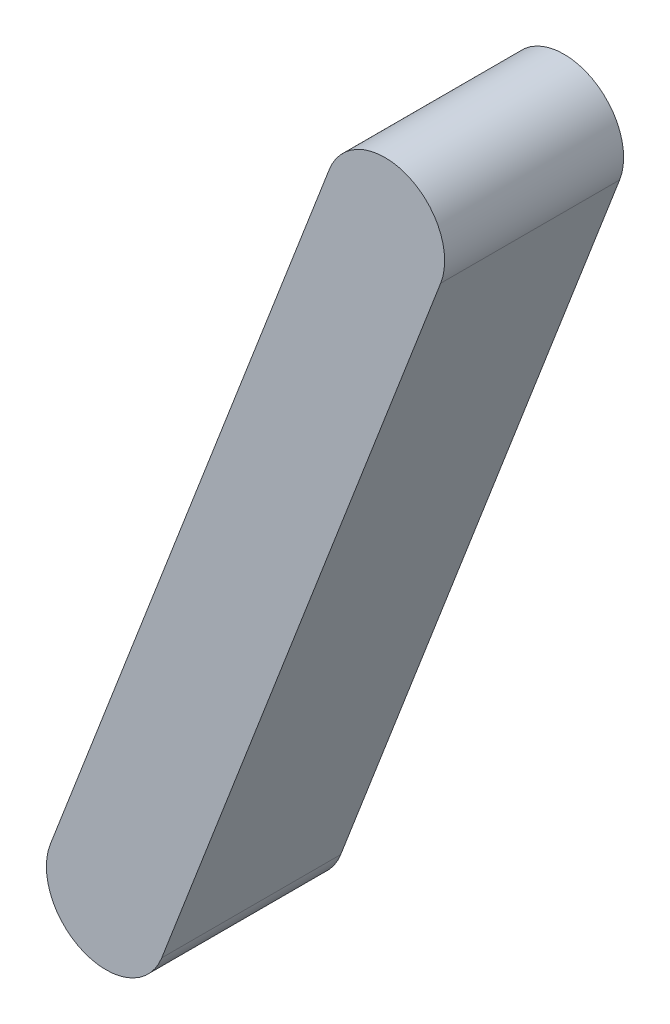
from build123d import *

# Parameters (mm, degrees)
EXTRUDE_1_DEPTH = 15


with BuildPart() as part:
    # 草图1 → 凸台-拉伸1 (new, symmetric)
    with BuildSketch(Plane.XY):
        with BuildLine():
            Line((-26.591339139, -44.421289261), (20.161349235, 76.880755775))
            ThreePointArc((20.161349235, 76.880755775), (33.08863642, 82.615321672), (38.823202317, 69.688034486))
            Line((38.823202317, 69.688034486), (-7.929486057, -51.614010549))
            ThreePointArc((-7.929486057, -51.614010549), (-20.856773242, -57.348576446), (-26.591339139, -44.421289261))
        make_face()
    extrude(amount=EXTRUDE_1_DEPTH, both=True)


solid = part.part
